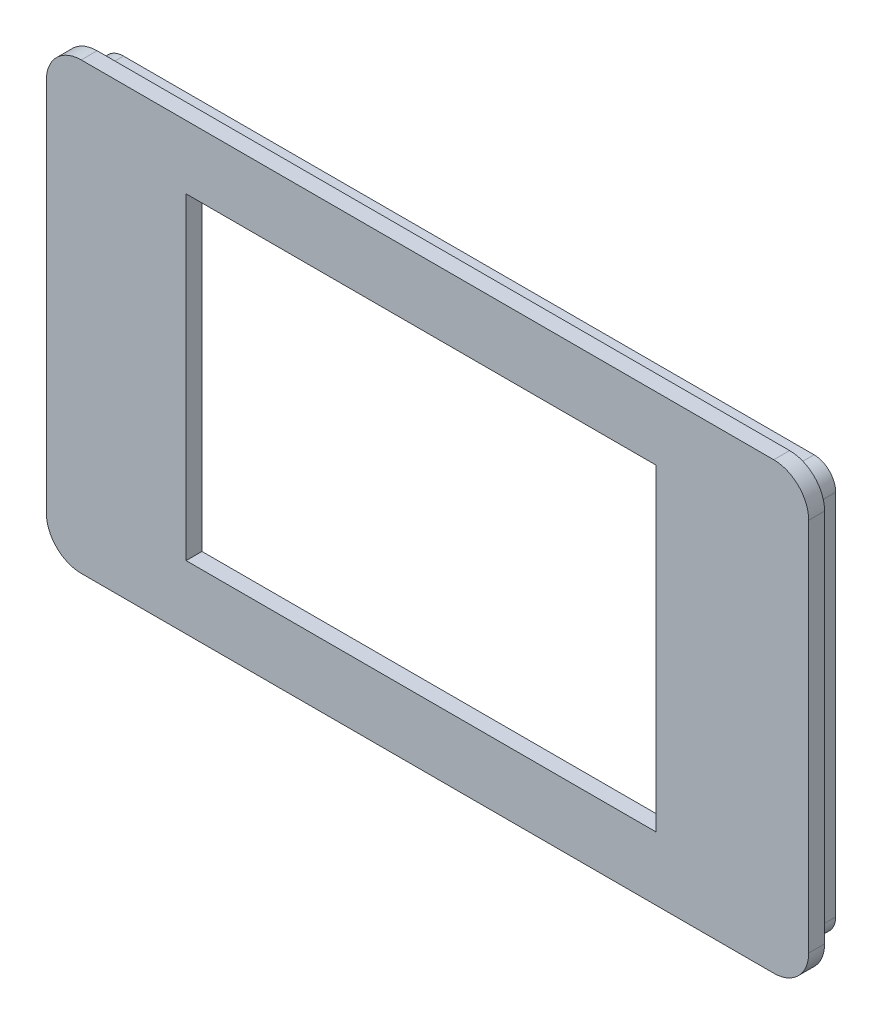
from build123d import *

# Parameters (mm, degrees)
SKETCH_1_W        = 120
SKETCH_1_H        = 70
SKETCH_1_W_2      = 74
SKETCH_1_H_2      = 50
EXTRUDE_1_DEPTH   = 2.5
FILLET_1_R        = 5.5
EXTRUDE_1_2_DEPTH = 4


with BuildPart() as part:
    # 草图1 → Extrude 1 (new body)
    with BuildSketch(Plane.XY):
        with Locations((8.671272412, 0.068259877)):
            Rectangle(SKETCH_1_W, SKETCH_1_H)
        with Locations((7.671272412, 0.068259877)):
            Rectangle(SKETCH_1_W_2, SKETCH_1_H_2, mode=Mode.SUBTRACT)
    extrude(amount=EXTRUDE_1_DEPTH)

    # 圆角1
    fillet_1_edges = [part.edges().sort_by_distance(p)[0] for p in [
        (-51.328727588, 35.068259877, 1.25),
        (68.671272412, 35.068259877, 1.25),
        (68.671272412, -34.931740123, 1.25),
        (-51.328727588, -34.931740123, 1.25),
    ]]
    fillet(fillet_1_edges, radius=FILLET_1_R)

    # 草图2 → Extrude 1 2 (add)
    with BuildSketch(Plane(origin=(0, 0, 0), x_dir=(-1, 0, 0), z_dir=(0, 0, -1))):
        with BuildLine():
            Line((-63.021272412, 32.418259877), (45.678727588, 32.418259877))
            ThreePointArc((45.678727588, 32.418259877), (48.082890644, 31.422422933), (49.078727588, 29.018259877))
            Line((49.078727588, 29.018259877), (49.078727588, -28.881740123))
            ThreePointArc((49.078727588, -28.881740123), (48.082890644, -31.285903179), (45.678727588, -32.281740123))
            Line((45.678727588, -32.281740123), (-63.021272412, -32.281740123))
            ThreePointArc((-63.021272412, -32.281740123), (-65.425435468, -31.285903179), (-66.421272412, -28.881740123))
            Line((-66.421272412, -28.881740123), (-66.421272412, 29.018259877))
            ThreePointArc((-66.421272412, 29.018259877), (-65.425435468, 31.422422933), (-63.021272412, 32.418259877))
        make_face()
        with BuildLine():
            Line((-63.021272412, 30.418259877), (45.678727588, 30.418259877))
            ThreePointArc((45.678727588, 30.418259877), (46.668677082, 30.008209371), (47.078727588, 29.018259877))
            Line((47.078727588, 29.018259877), (47.078727588, -28.881740123))
            ThreePointArc((47.078727588, -28.881740123), (46.668677082, -29.871689616), (45.678727588, -30.281740123))
            Line((45.678727588, -30.281740123), (-63.021272412, -30.281740123))
            ThreePointArc((-63.021272412, -30.281740123), (-64.011221906, -29.871689616), (-64.421272412, -28.881740123))
            Line((-64.421272412, -28.881740123), (-64.421272412, 29.018259877))
            ThreePointArc((-64.421272412, 29.018259877), (-64.011221906, 30.008209371), (-63.021272412, 30.418259877))
        make_face(mode=Mode.SUBTRACT)
    extrude(amount=EXTRUDE_1_2_DEPTH)


solid = part.part
